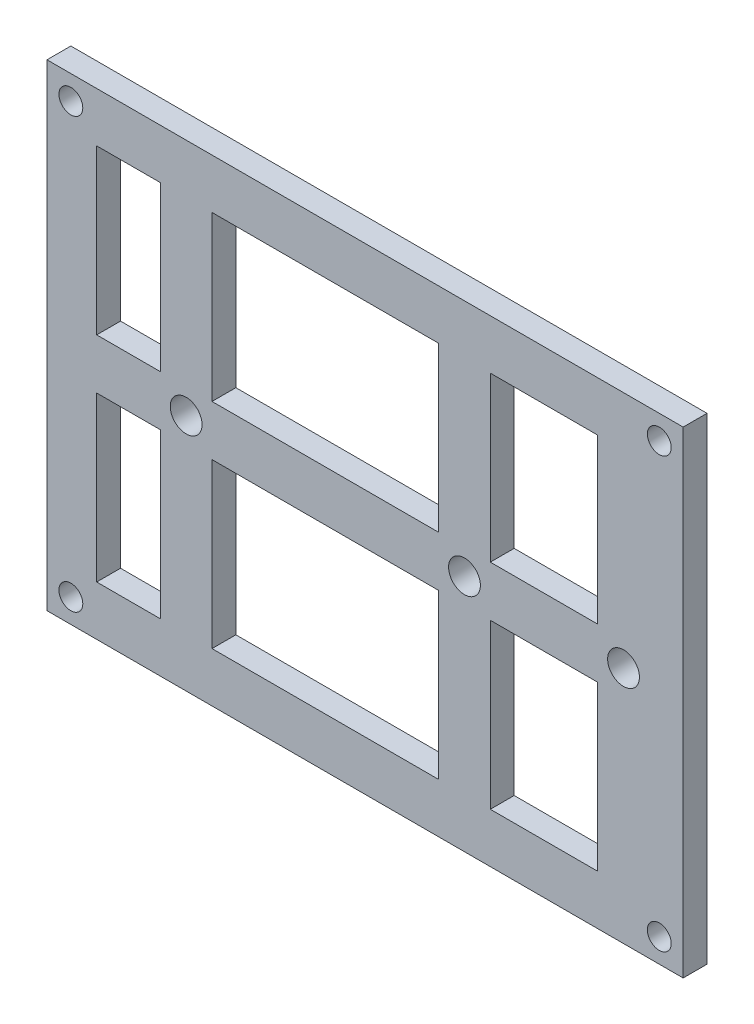
from build123d import *

# Parameters (mm, degrees)
SKETCH1_W           = 80
SKETCH1_H           = 60
SKETCH1_R           = 1.5
SKETCH1_R_2         = 2
SKETCH1_W_2         = 13.5
SKETCH1_H_2         = 20.585457955
SKETCH1_W_3         = 28.5
SKETCH1_W_4         = 8
BOSS_EXTRUDE1_DEPTH = 3


with BuildPart() as part:
    # Sketch1 → Boss-Extrude1 (new body)
    with BuildSketch(Plane.XY):
        Rectangle(SKETCH1_W, SKETCH1_H)
        with Locations((-37, 27)):
            Circle(SKETCH1_R, mode=Mode.SUBTRACT)
        with Locations(Location((-37, -27, 0), (0, 0, 180))):
            Circle(SKETCH1_R, mode=Mode.SUBTRACT)
        with Locations((37, -27)):
            Circle(SKETCH1_R, mode=Mode.SUBTRACT)
        with Locations(Location((37, 27, 0), (0, 0, 180))):
            Circle(SKETCH1_R, mode=Mode.SUBTRACT)
        with Locations((32.5, 0)):
            Circle(SKETCH1_R_2, mode=Mode.SUBTRACT)
        with Locations((12.5, 0)):
            Circle(SKETCH1_R_2, mode=Mode.SUBTRACT)
        with Locations((-22.5, 0)):
            Circle(SKETCH1_R_2, mode=Mode.SUBTRACT)
        with Locations((22.5, -13.457271023)):
            Rectangle(SKETCH1_W_2, SKETCH1_H_2, mode=Mode.SUBTRACT)
        with Locations((-5, 13.457271023)):
            Rectangle(SKETCH1_W_3, SKETCH1_H_2, mode=Mode.SUBTRACT)
        with Locations((22.5, 13.457271023)):
            Rectangle(SKETCH1_W_2, SKETCH1_H_2, mode=Mode.SUBTRACT)
        with Locations((-29.75, 13.457271023)):
            Rectangle(SKETCH1_W_4, SKETCH1_H_2, mode=Mode.SUBTRACT)
        with Locations((-5, -13.457271023)):
            Rectangle(SKETCH1_W_3, SKETCH1_H_2, mode=Mode.SUBTRACT)
        with Locations((-29.75, -13.457271023)):
            Rectangle(SKETCH1_W_4, SKETCH1_H_2, mode=Mode.SUBTRACT)
    extrude(amount=BOSS_EXTRUDE1_DEPTH)


solid = part.part
